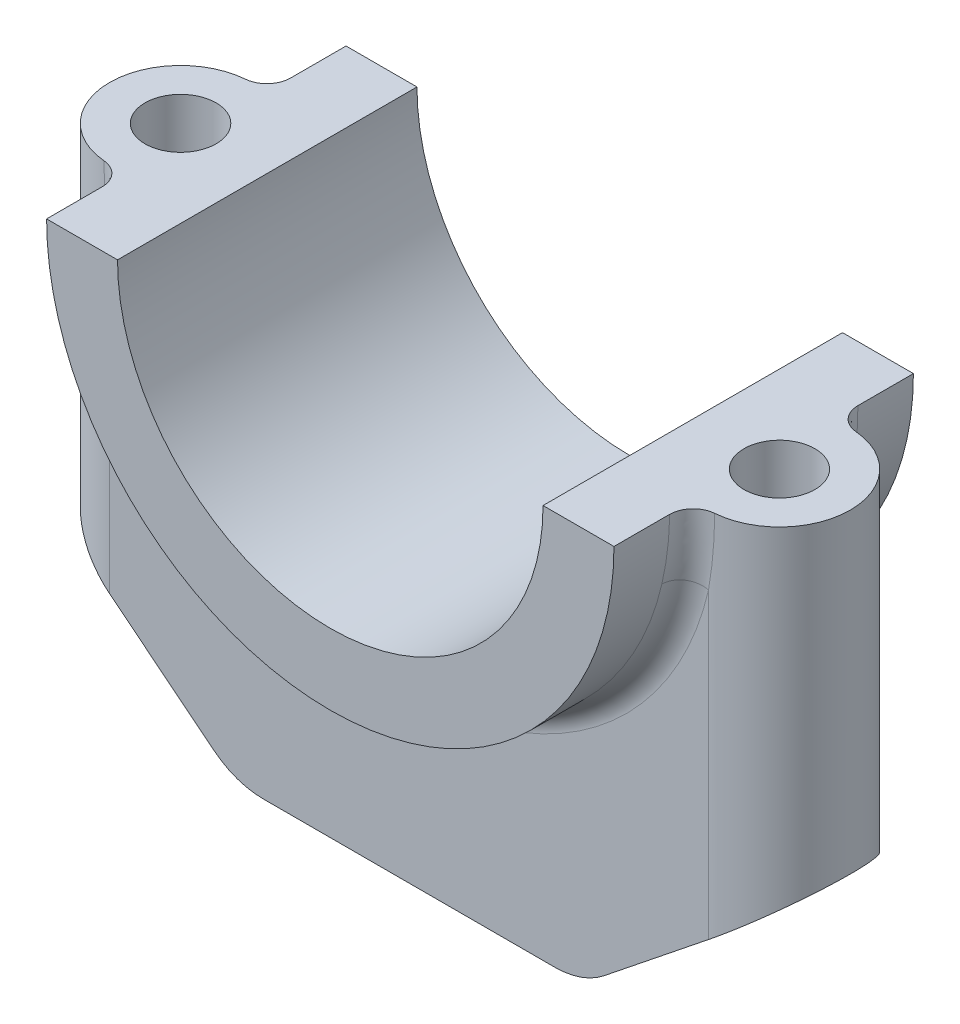
from build123d import *

# Parameters (mm, degrees)
BOSS_EXTRUDE1_DEPTH = 19
BOSS_EXTRUDE2_DEPTH = 9
SKETCH2_R           = 4.5
BOSS_EXTRUDE3_DEPTH = 60
CUT_EXTRUDE1_START  = -18
CUT_EXTRUDE1_DEPTH  = 18
CUT_EXTRUDE2_START  = -68
SKETCH4_R           = 4.511504631
SKETCH4_R_2         = 4.5
CUT_EXTRUDE2_DEPTH  = 68
CUT_EXTRUDE3_DEPTH  = 34
FILLET1_R           = 10
FILLET2_R           = 3


with BuildPart() as part:
    # Sketch1 → Boss-Extrude1 (new, symmetric)
    with BuildSketch(Plane.XY):
        with BuildLine():
            Line((-36, 0), (-27, 0))
            ThreePointArc((-27, 0), (0, -27), (27, 0))
            Line((27, 0), (36, 0))
            ThreePointArc((36, 0), (0, -36), (-36, 0))
        make_face()
    extrude(amount=BOSS_EXTRUDE1_DEPTH, both=True)

    # Sketch1<3> → Boss-Extrude2 (add, symmetric)
    with BuildSketch(Plane.XY):
        with BuildLine():
            ThreePointArc((-36, 0), (0, -36), (36, 0))
            Line((36, 0), (36, -60))
            Line((36, -60), (-36, -60))
            Line((-36, -60), (-36, 0))
        make_face()
    extrude(amount=BOSS_EXTRUDE2_DEPTH, both=True)

    # Sketch2 → Boss-Extrude3 (add)
    with BuildSketch(Plane.XZ.offset(60)):
        with BuildLine():
            Line((-38, 9), (38, 9))
            ThreePointArc((38, 9), (47, 0), (38, -9))
            Line((38, -9), (-38, -9))
            ThreePointArc((-38, -9), (-47, 0), (-38, 9))
        make_face()
        with Locations((-38, 0)):
            Circle(SKETCH2_R, mode=Mode.SUBTRACT)
        with Locations((38, 0)):
            Circle(SKETCH2_R, mode=Mode.SUBTRACT)
    extrude(amount=-BOSS_EXTRUDE3_DEPTH)

    # Sketch3 → Cut-Extrude1 (cut)
    with BuildSketch(Plane(origin=(0, 0, -9), x_dir=(-1, 0, 0), z_dir=(0, 0, -1)).offset(CUT_EXTRUDE1_START)):
        with BuildLine():
            Line((27, 0), (-27, 0))
            ThreePointArc((-27, 0), (0, -27), (27, 0))
        make_face()
    extrude(amount=CUT_EXTRUDE1_DEPTH, mode=Mode.SUBTRACT)

    # Sketch4 → Cut-Extrude2 (cut)
    with BuildSketch(Plane(origin=(0, 0, 0), x_dir=(1, 0, 0), z_dir=(0, 1, 0)).offset(CUT_EXTRUDE2_START)):
        with Locations(Location((-38, 0, 0), (0, 0, 180))):
            Circle(SKETCH4_R)
        with Locations(Location((38, 0, 0), (0, 0, 90))):
            Circle(SKETCH4_R_2)
    extrude(amount=CUT_EXTRUDE2_DEPTH, mode=Mode.SUBTRACT)

    # Sketch5 → Cut-Extrude3 (cut, symmetric)
    with BuildSketch(Plane.XY):
        Polygon((-47, -60), (-22, -60), (-47, -40), align=None)
        Polygon((47, -60), (47, -40), (22, -60), align=None)
    extrude(amount=CUT_EXTRUDE3_DEPTH, both=True, mode=Mode.SUBTRACT)

    # Fillet1
    fillet1_edges = [part.edges().sort_by_distance(p)[0] for p in [
        (-22, -60, 0),
        (22, -60, 0),
    ]]
    fillet(fillet1_edges, radius=FILLET1_R)

    # Fillet2
    fillet2_edges = [part.edges().sort_by_distance(p)[0] for p in [
        (0, -36, 9),
        (0, -36, -9),
    ]]
    fillet(fillet2_edges, radius=FILLET2_R)


solid = part.part
